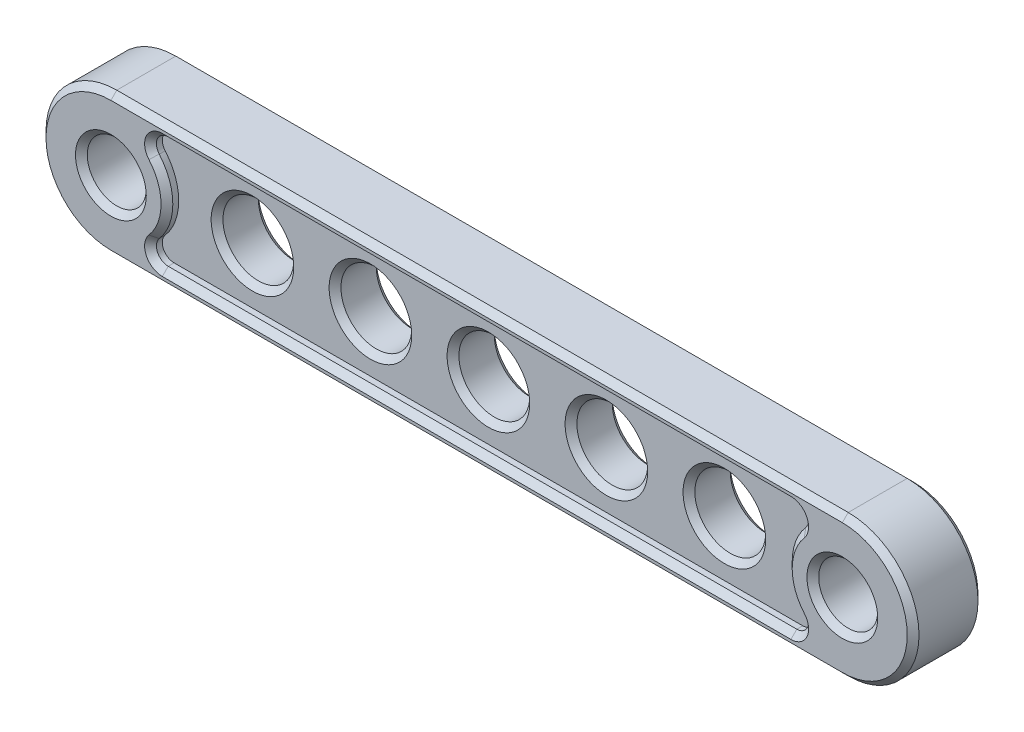
from build123d import *

# Parameters (mm, degrees)
SKETCH1_R           = 2.5
BOSS_EXTRUDE1_DEPTH = 3
CUT_EXTRUDE1_DEPTH  = 1
SKETCH3_R           = 3
CUT_EXTRUDE2_DEPTH  = 38.815340802
CHAMFER1_SIZE       = 0.5
CHAMFER2_SIZE       = 0.5


with BuildPart() as part:
    # Sketch1 → Boss-Extrude1 (new, symmetric)
    with BuildSketch(Plane.XY):
        with BuildLine():
            Line((-31, 6), (31, 6))
            ThreePointArc((31, 6), (37, 0), (31, -6))
            Line((31, -6), (-31, -6))
            ThreePointArc((-31, -6), (-37, 0), (-31, 6))
        make_face()
        with Locations((-31, 0)):
            Circle(SKETCH1_R, mode=Mode.SUBTRACT)
        with Locations((31, 0)):
            Circle(SKETCH1_R, mode=Mode.SUBTRACT)
    extrude(amount=BOSS_EXTRUDE1_DEPTH, both=True)

    # Sketch2 → Cut-Extrude1 (cut)
    with BuildSketch(Plane.XY.offset(3)):
        with BuildLine():
            Line((-26.641101056, 4.75), (26.641101056, 4.75))
            ThreePointArc((26.641101056, 4.75), (27.549994316, 4.167028828), (27.399170438, 3.097826087))
            ThreePointArc((27.399170438, 3.097826087), (26.25, 0), (27.399170438, -3.097826087))
            ThreePointArc((27.399170438, -3.097826087), (27.549994316, -4.167028828), (26.641101056, -4.75))
            Line((26.641101056, -4.75), (-26.641101056, -4.75))
            ThreePointArc((-26.641101056, -4.75), (-27.549994316, -4.167028828), (-27.399170438, -3.097826087))
            ThreePointArc((-27.399170438, -3.097826087), (-26.25, 0), (-27.399170438, 3.097826087))
            ThreePointArc((-27.399170438, 3.097826087), (-27.549994316, 4.167028828), (-26.641101056, 4.75))
        make_face()
    cut_extrude1 = extrude(amount=-CUT_EXTRUDE1_DEPTH, mode=Mode.SUBTRACT)

    # Mirror1: Cut-Extrude1 across plane
    add(cut_extrude1.mirror(Plane.XY), mode=Mode.SUBTRACT)

    # Sketch3 → Cut-Extrude2 (cut, through all)
    with BuildSketch(Plane.XY.offset(2)):
        Circle(SKETCH3_R)
        with Locations((-20, 0)):
            Circle(SKETCH3_R)
        with Locations((-10, 0)):
            Circle(SKETCH3_R)
        with Locations((10, 0)):
            Circle(SKETCH3_R)
        with Locations((20, 0)):
            Circle(SKETCH3_R)
    extrude(amount=-CUT_EXTRUDE2_DEPTH, mode=Mode.SUBTRACT)

    # Chamfer1
    chamfer1_edges = [part.edges().sort_by_distance(p)[0] for p in [
        (-33.5, 0, 3),
        (37, 0, 3),
        (28.5, 0, 3),
        (0, 6, 3),
        (27.549994316, -4.167028828, 3),
        (26.25, 0, 3),
        (27.549994316, 4.167028828, 3),
        (0, 4.75, 3),
        (-27.549994316, 4.167028828, 3),
        (-26.25, 0, 3),
        (-27.549994316, -4.167028828, 3),
        (0, -4.75, 3),
        (-37, 0, 3),
        (17, 0, 2),
        (7, 0, 2),
        (-13, 0, 2),
        (-23, 0, 2),
        (-3, 0, 2),
        (0, -6, 3),
    ]]
    chamfer(chamfer1_edges, length=CHAMFER1_SIZE)

    # Chamfer2
    chamfer2_edges = [part.edges().sort_by_distance(p)[0] for p in [
        (-33.5, 0, -3),
        (28.5, 0, -3),
        (27.549994316, -4.167028828, -3),
        (26.25, 0, -3),
        (0, 6, -3),
        (27.549994316, 4.167028828, -3),
        (0, 4.75, -3),
        (-27.549994316, 4.167028828, -3),
        (-26.25, 0, -3),
        (-27.549994316, -4.167028828, -3),
        (0, -4.75, -3),
        (37, 0, -3),
        (0, -6, -3),
        (-37, 0, -3),
        (17, 0, -2),
        (7, 0, -2),
        (-13, 0, -2),
        (-23, 0, -2),
        (-3, 0, -2),
    ]]
    chamfer(chamfer2_edges, length=CHAMFER2_SIZE)


solid = part.part
